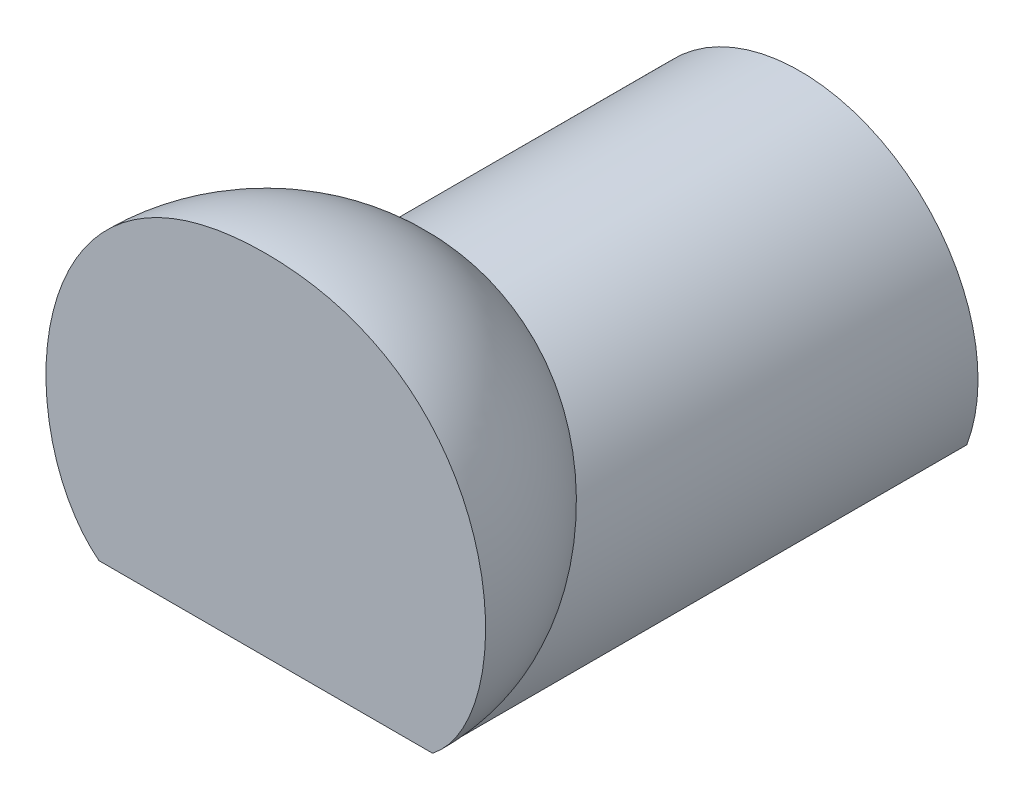
from build123d import *

# Parameters (mm, degrees)
BOSS_EXTRUDE1_DEPTH = 45
REVOLVE1_ANGLE      = 180
BOSS_EXTRUDE2_DEPTH = 15


with BuildPart() as part:
    # Sketch1 → Boss-Extrude1 (new body)
    with BuildSketch(Plane.XY):
        with BuildLine():
            Line((0, 0), (37.46998799, 0))
            ThreePointArc((37.46998799, 0), (18.734993995, 27), (0, 0))
        make_face()
    extrude(amount=BOSS_EXTRUDE1_DEPTH)



with BuildPart() as body_2:
    # Sketch4 → Revolve1 (revolve)
    with BuildSketch(Plane.XY.offset(60)):
        with BuildLine():
            Line((18.734993995, 0), (18.734993995, 39.259436234))
            add(Edge.make_bspline(
                [(18.734993995, 39.259436234), (46.178787864, 39.232586668), (48.009362148, 8.206101436), (37.46998799, 0)],
                knots=[0, 0, 0, 0, 1, 1, 1, 1], degree=3))
            Line((37.46998799, 0), (18.734993995, 0))
        make_face()
    revolve(axis=Axis((18.734993995, 0, 60), (0, 1, 0)), revolution_arc=REVOLVE1_ANGLE)


with BuildPart() as part_1:
    add(part.part)

    add(body_2.part)  # Boss-Extrude2 merges body 2
    # Sketch5 → Boss-Extrude2 (add)
    with BuildSketch(Plane.XY.offset(45)):
        with BuildLine():
            Line((0, 0), (37.46998799, 0))
            ThreePointArc((37.46998799, 0), (18.734993995, 27), (0, 0))
        make_face()
    extrude(amount=BOSS_EXTRUDE2_DEPTH)


solid = part_1.part
